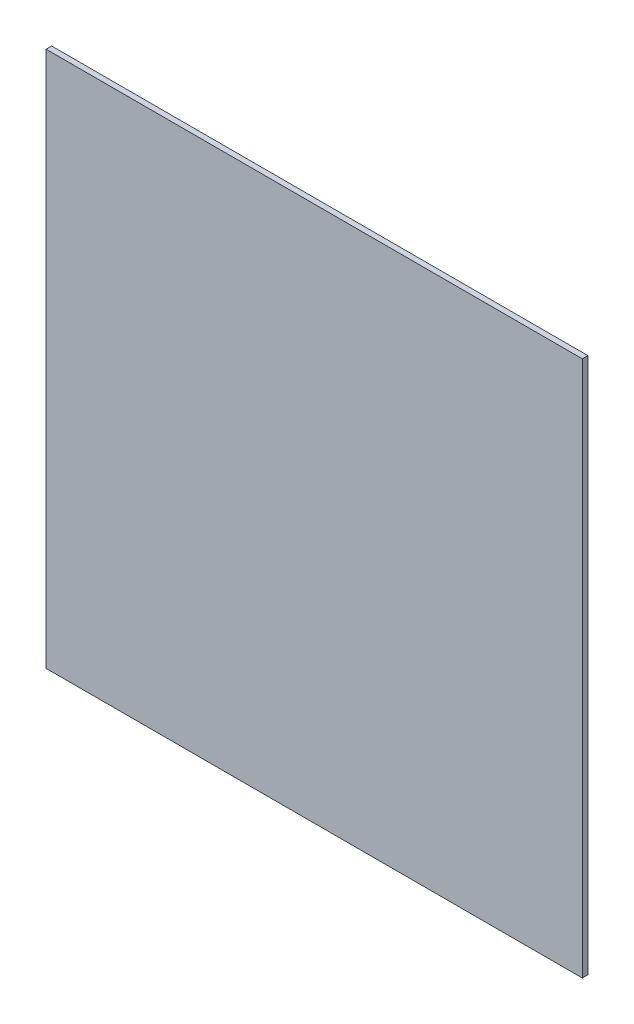
from build123d import *

# Parameters (mm, degrees)
SKETCH2_W           = 609.6
SKETCH2_H           = 609.6
BOSS_EXTRUDE1_DEPTH = 6.35


with BuildPart() as part:
    # Sketch2 → Boss-Extrude1 (new body)
    with BuildSketch(Plane.XY):
        Rectangle(SKETCH2_W, SKETCH2_H)
    extrude(amount=BOSS_EXTRUDE1_DEPTH)


solid = part.part
